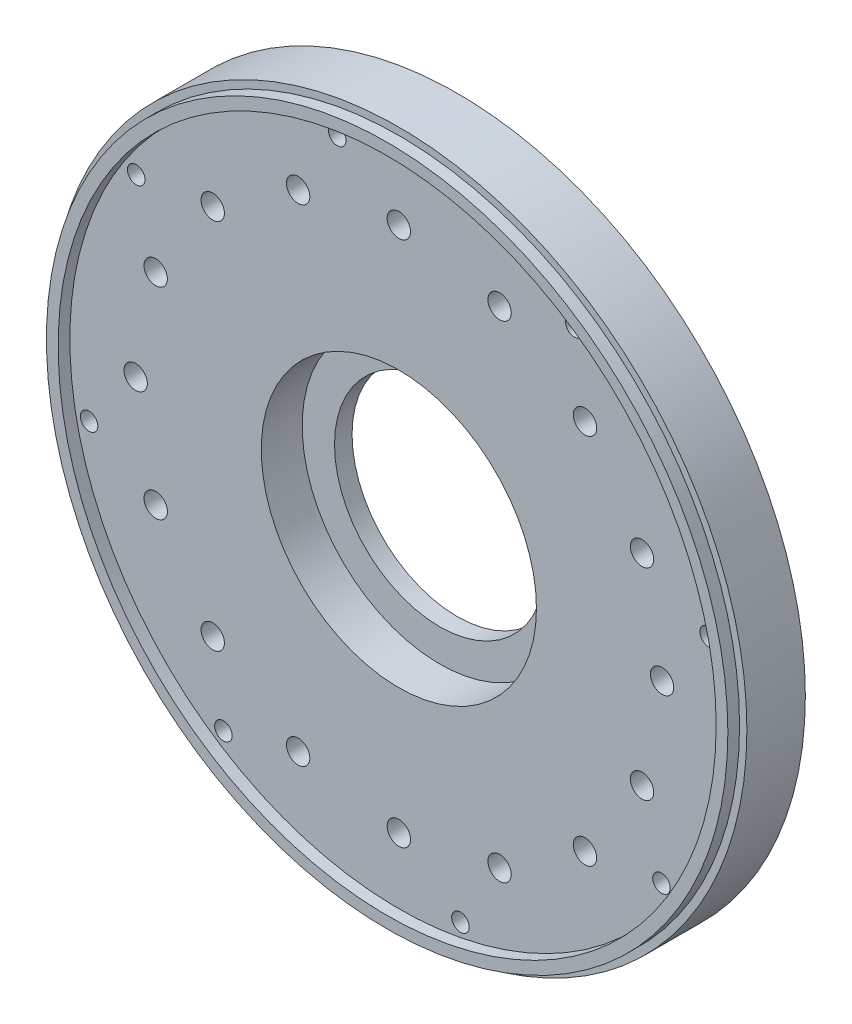
from build123d import *

# Parameters (mm, degrees)
SKETCH1_R           = 59.5
BOSS_EXTRUDE1_DEPTH = 10
SKETCH4_R           = 23.525
CUT_EXTRUDE2_DEPTH  = 7
SKETCH5_R           = 18
CUT_EXTRUDE3_DEPTH  = 85.436366573
SKETCH7_R           = 2
CUT_EXTRUDE4_DEPTH  = 4
SKETCH8_R           = 1.5
CUT_EXTRUDE5_DEPTH  = 85.737830985
SKETCH10_R          = 58.25
SKETCH10_R_2        = 57.25
SKETCH10_R_3        = 56.25
BOSS_EXTRUDE2_DEPTH = 2


with BuildPart() as part:
    # Sketch1 → Boss-Extrude1 (new body)
    with BuildSketch(Plane.XY):
        Circle(SKETCH1_R)
    extrude(amount=BOSS_EXTRUDE1_DEPTH)

    # Sketch4 → Cut-Extrude2 (cut)
    with BuildSketch(Plane.XY.offset(10)):
        Circle(SKETCH4_R)
    extrude(amount=-CUT_EXTRUDE2_DEPTH, mode=Mode.SUBTRACT)

    # Sketch5 → Cut-Extrude3 (cut, through all)
    with BuildSketch(Plane.XY.offset(3)):
        Circle(SKETCH5_R)
    extrude(amount=-CUT_EXTRUDE3_DEPTH, mode=Mode.SUBTRACT)

    # Sketch7 → Cut-Extrude4 (cut)
    with BuildSketch(Plane.XY.offset(10)):
        with Locations((45, 0)):
            Circle(SKETCH7_R)
        with Locations((41.574578963, -17.220754456)):
            Circle(SKETCH7_R)
        with Locations((31.819805153, -31.819805153)):
            Circle(SKETCH7_R)
        with Locations((17.220754456, -41.574578963)):
            Circle(SKETCH7_R)
        with Locations((0, -45)):
            Circle(SKETCH7_R)
        with Locations((-17.220754456, -41.574578963)):
            Circle(SKETCH7_R)
        with Locations((-31.819805153, -31.819805153)):
            Circle(SKETCH7_R)
        with Locations((-41.574578963, -17.220754456)):
            Circle(SKETCH7_R)
        with Locations((-45, 0)):
            Circle(SKETCH7_R)
        with Locations((-41.574578963, 17.220754456)):
            Circle(SKETCH7_R)
        with Locations((-31.819805153, 31.819805153)):
            Circle(SKETCH7_R)
        with Locations((-17.220754456, 41.574578963)):
            Circle(SKETCH7_R)
        with Locations((0, 45)):
            Circle(SKETCH7_R)
        with Locations((17.220754456, 41.574578963)):
            Circle(SKETCH7_R)
        with Locations((31.819805153, 31.819805153)):
            Circle(SKETCH7_R)
        with Locations((41.574578963, 17.220754456)):
            Circle(SKETCH7_R)
    extrude(amount=-CUT_EXTRUDE4_DEPTH, mode=Mode.SUBTRACT)

    # Sketch8 → Cut-Extrude5 (cut, through all)
    with BuildSketch(Plane.XY.offset(10)):
        with Locations((30.000792583, 44.899359064)):
            Circle(SKETCH8_R)
        with Locations((52.962405142, 10.534877389)):
            Circle(SKETCH8_R)
        with Locations((44.899359064, -30.000792583)):
            Circle(SKETCH8_R)
        with Locations((10.534877389, -52.962405142)):
            Circle(SKETCH8_R)
        with Locations((-30.000792583, -44.899359064)):
            Circle(SKETCH8_R)
        with Locations((-52.962405142, -10.534877389)):
            Circle(SKETCH8_R)
        with Locations((-44.899359064, 30.000792583)):
            Circle(SKETCH8_R)
        with Locations((-10.534877389, 52.962405142)):
            Circle(SKETCH8_R)
    extrude(amount=-CUT_EXTRUDE5_DEPTH, mode=Mode.SUBTRACT)

    # Sketch10 → Boss-Extrude2 (add)
    # profile 1 of 2: a face of its own
    with BuildSketch(Plane.XY.offset(10)):
        Circle(SKETCH10_R)
        Circle(SKETCH10_R_2, mode=Mode.SUBTRACT)
    # profile 2 of 2: a face of its own
    with BuildSketch(Plane.XY.offset(10)):
        Circle(SKETCH10_R_2)
        Circle(SKETCH10_R_3, mode=Mode.SUBTRACT)
    extrude(amount=BOSS_EXTRUDE2_DEPTH)


solid = part.part
